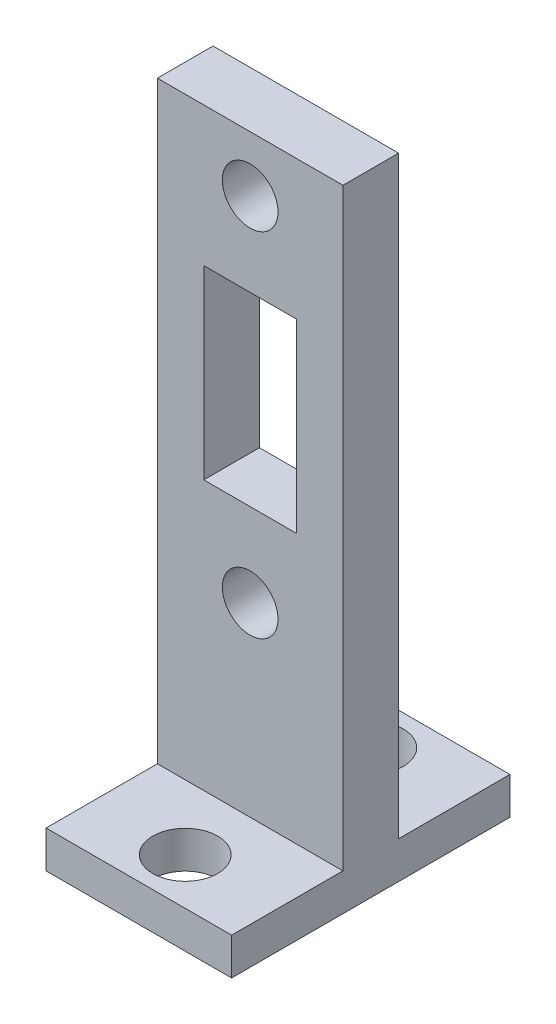
from build123d import *

# Parameters (mm, degrees)
CROQUIS1_W              = 10
CROQUIS1_H              = 15
CROQUIS1_R              = 1.75
SALIENTE_EXTRUIR1_DEPTH = 2
CROQUIS2_W              = 10
CROQUIS2_H              = 3
SALIENTE_EXTRUIR2_DEPTH = 32
CROQUIS3_R              = 1.5
CORTAR_EXTRUIR1_DEPTH   = 36.524639337
CROQUIS4_W              = 5
CROQUIS4_H              = 10
CORTAR_EXTRUIR2_DEPTH   = 36.524639337


with BuildPart() as part:
    # Croquis1 → Saliente-Extruir1 (new body)
    with BuildSketch(Plane(origin=(0, 0, 0), x_dir=(1, 0, 0), z_dir=(0, 1, 0))):
        Rectangle(CROQUIS1_W, CROQUIS1_H)
        with Locations(Location((0, 5, 0), (0, 0, 270))):
            Circle(CROQUIS1_R, mode=Mode.SUBTRACT)
        with Locations(Location((0, -5, 0), (0, 0, 270))):
            Circle(CROQUIS1_R, mode=Mode.SUBTRACT)
    extrude(amount=SALIENTE_EXTRUIR1_DEPTH)

    # Croquis2 → Saliente-Extruir2 (add)
    with BuildSketch(Plane(origin=(0, 2, 0), x_dir=(1, 0, 0), z_dir=(0, 1, 0))):
        Rectangle(CROQUIS2_W, CROQUIS2_H)
    extrude(amount=SALIENTE_EXTRUIR2_DEPTH)

    # Croquis3 → Cortar-Extruir1 (cut, through all)
    with BuildSketch(Plane.XY.offset(1.5)):
        with Locations((0, 31)):
            Circle(CROQUIS3_R)
        with Locations((0, 12)):
            Circle(CROQUIS3_R)
    extrude(amount=-CORTAR_EXTRUIR1_DEPTH, mode=Mode.SUBTRACT)

    # Croquis4 → Cortar-Extruir2 (cut, through all)
    with BuildSketch(Plane.XY.offset(1.5)):
        with Locations((0, 21.5)):
            Rectangle(CROQUIS4_W, CROQUIS4_H)
    extrude(amount=-CORTAR_EXTRUIR2_DEPTH, mode=Mode.SUBTRACT)


solid = part.part
